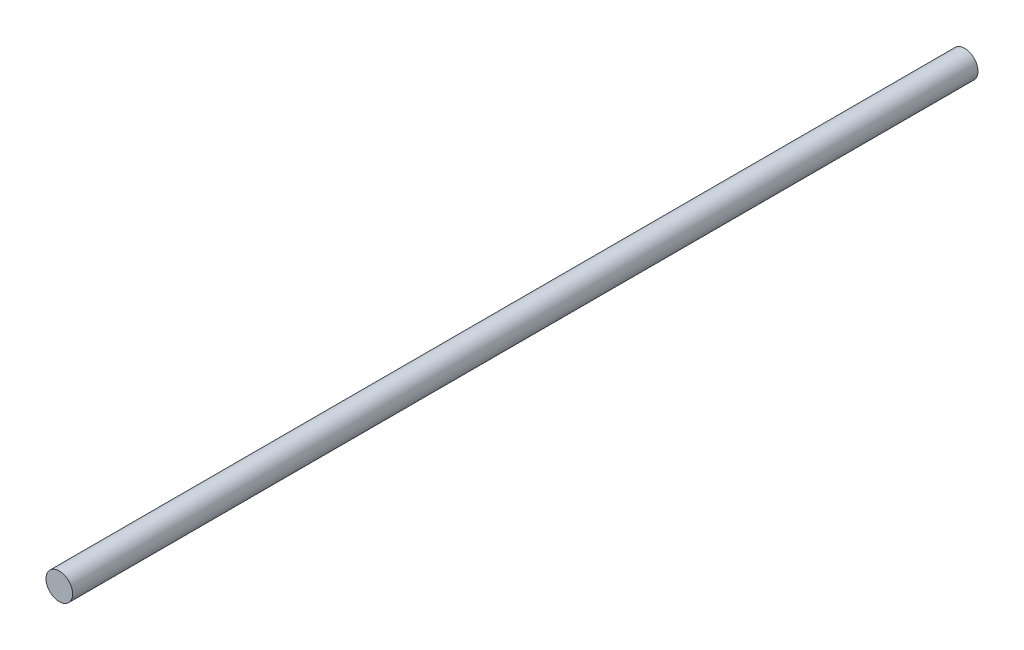
from build123d import *

# Parameters (mm, degrees)
SKETCH1_R           = 2.5
BOSS_EXTRUDE1_DEPTH = 170


with BuildPart() as part:
    # Sketch1 → Boss-Extrude1 (new body)
    with BuildSketch(Plane.XY):
        Circle(SKETCH1_R)
    extrude(amount=BOSS_EXTRUDE1_DEPTH)


solid = part.part
